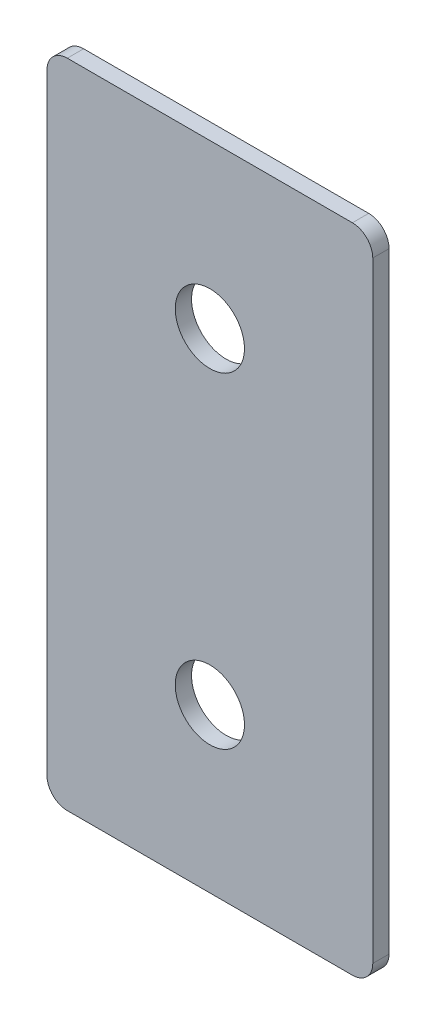
from build123d import *

# Parameters (mm, degrees)
SKETCH1_W           = 40
SKETCH1_H           = 80
BOSS_EXTRUDE1_DEPTH = 2
SKETCH2_R           = 4.25
CUT_EXTRUDE1_DEPTH  = 2
FILLET1_R           = 2.5


with BuildPart() as part:
    # Sketch1 → Boss-Extrude1 (new body)
    with BuildSketch(Plane.XY):
        Rectangle(SKETCH1_W, SKETCH1_H)
    extrude(amount=BOSS_EXTRUDE1_DEPTH)

    # Sketch2 → Cut-Extrude1 (cut)
    with BuildSketch(Plane.XY.offset(2)):
        with Locations((0, 20)):
            Circle(SKETCH2_R)
        with Locations((0, -20)):
            Circle(SKETCH2_R)
    extrude(amount=-CUT_EXTRUDE1_DEPTH, mode=Mode.SUBTRACT)

    # Fillet1
    fillet1_edges = [part.edges().sort_by_distance(p)[0] for p in [
        (-20, 40, 1),
        (20, 40, 1),
        (20, -40, 1),
        (-20, -40, 1),
    ]]
    fillet(fillet1_edges, radius=FILLET1_R)


solid = part.part
